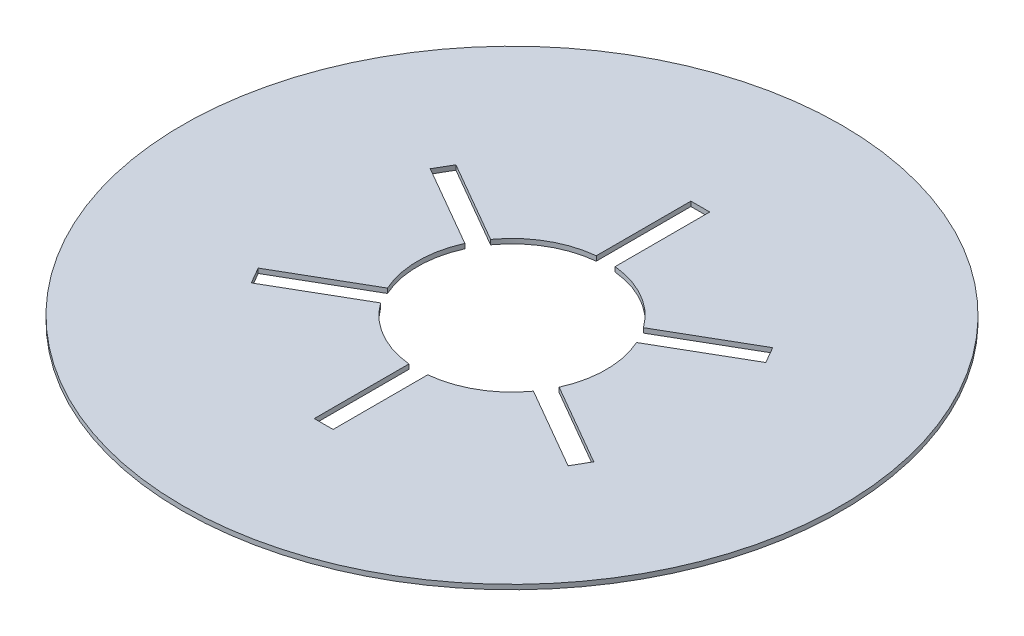
from build123d import *

# Parameters (mm, degrees)
IZIM1_R                     = 350
Y_KSEKLIK_EKSTR_ZYON1_DEPTH = 5


with BuildPart() as part:
    # Çizim1 → Yükseklik-Ekstrüzyon1 (new body)
    # profile 1 of 7: a face of its own
    with BuildSketch(Plane(origin=(0, 0, 0), x_dir=(1, 0, 0), z_dir=(0, 1, 0))):
        with Locations(Location((0, 0, 0), (0, 0, 270))):
            Circle(IZIM1_R)
        with BuildLine():
            ThreePointArc((70.062926922, 71.352549156), (75.892103529, 65.118266423), (81.168439698, 58.409625893))
            Line((81.168439698, 58.409625893), (168.205080757, 108.660254038))
            Line((168.205080757, 108.660254038), (178.205080757, 91.339745962))
            Line((178.205080757, 91.339745962), (91.168439698, 41.089117818))
            ThreePointArc((91.168439698, 41.089117818), (94.340124737, 33.165356392), (96.824583655, 25))
            Line((96.824583655, 25), (150, 55.700840941))
            Line((150, 55.700840941), (150, -55.700840941))
            Line((150, -55.700840941), (96.824583655, -25))
            ThreePointArc((96.824583655, -25), (94.340124737, -33.165356392), (91.168439698, -41.089117817))
            Line((91.168439698, -41.089117817), (178.205080757, -91.339745962))
            Line((178.205080757, -91.339745962), (168.205080757, -108.660254038))
            Line((168.205080757, -108.660254038), (81.168439698, -58.409625893))
            ThreePointArc((81.168439698, -58.409625893), (75.892103529, -65.118266423), (70.062926922, -71.352549156))
            Line((70.062926922, -71.352549156), (123.238343267, -102.053390097))
            Line((123.238343267, -102.053390097), (26.761656733, -157.754231038))
            Line((26.761656733, -157.754231038), (26.761656733, -96.352549156))
            ThreePointArc((26.761656733, -96.352549156), (18.448021208, -98.283622814), (10, -99.498743711))
            Line((10, -99.498743711), (10, -200))
            Line((10, -200), (-10, -200))
            Line((-10, -200), (-10, -99.498743711))
            ThreePointArc((-10, -99.498743711), (-18.448021208, -98.283622814), (-26.761656733, -96.352549156))
            Line((-26.761656733, -96.352549156), (-26.761656733, -157.754231038))
            Line((-26.761656733, -157.754231038), (-123.238343267, -102.053390097))
            Line((-123.238343267, -102.053390097), (-70.062926922, -71.352549156))
            ThreePointArc((-70.062926922, -71.352549156), (-75.892103529, -65.118266423), (-81.168439698, -58.409625893))
            Line((-81.168439698, -58.409625893), (-168.205080757, -108.660254038))
            Line((-168.205080757, -108.660254038), (-178.205080757, -91.339745962))
            Line((-178.205080757, -91.339745962), (-91.168439698, -41.089117817))
            ThreePointArc((-91.168439698, -41.089117817), (-94.340124737, -33.165356392), (-96.824583655, -25))
            Line((-96.824583655, -25), (-150, -55.700840941))
            Line((-150, -55.700840941), (-150, 55.700840941))
            Line((-150, 55.700840941), (-96.824583655, 25))
            ThreePointArc((-96.824583655, 25), (-94.340124737, 33.165356392), (-91.168439698, 41.089117818))
            Line((-91.168439698, 41.089117818), (-178.205080757, 91.339745962))
            Line((-178.205080757, 91.339745962), (-168.205080757, 108.660254038))
            Line((-168.205080757, 108.660254038), (-81.168439698, 58.409625893))
            ThreePointArc((-81.168439698, 58.409625893), (-75.892103529, 65.118266423), (-70.062926922, 71.352549156))
            Line((-70.062926922, 71.352549156), (-123.238343267, 102.053390097))
            Line((-123.238343267, 102.053390097), (-26.761656733, 157.754231038))
            Line((-26.761656733, 157.754231038), (-26.761656733, 96.352549156))
            ThreePointArc((-26.761656733, 96.352549156), (-18.448021208, 98.283622814), (-10, 99.498743711))
            Line((-10, 99.498743711), (-10, 200))
            Line((-10, 200), (10, 200))
            Line((10, 200), (10, 99.498743711))
            ThreePointArc((10, 99.498743711), (18.448021208, 98.283622814), (26.761656733, 96.352549156))
            Line((26.761656733, 96.352549156), (26.761656733, 157.754231038))
            Line((26.761656733, 157.754231038), (123.238343267, 102.053390097))
            Line((123.238343267, 102.053390097), (70.062926922, 71.352549156))
        make_face(mode=Mode.SUBTRACT)
    # profile 2 of 7: a face of its own
    with BuildSketch(Plane(origin=(0, 0, 0), x_dir=(1, 0, 0), z_dir=(0, 1, 0))):
        with BuildLine():
            Line((-26.761656733, -157.754231038), (-26.761656733, -96.352549156))
            ThreePointArc((-26.761656733, -96.352549156), (-50, -86.602540378), (-70.062926922, -71.352549156))
            Line((-70.062926922, -71.352549156), (-123.238343267, -102.053390097))
            Line((-123.238343267, -102.053390097), (-26.761656733, -157.754231038))
        make_face()
    # profile 3 of 7: a face of its own
    with BuildSketch(Plane(origin=(0, 0, 0), x_dir=(1, 0, 0), z_dir=(0, 1, 0))):
        with BuildLine():
            ThreePointArc((-96.824583655, -25), (-100, 0), (-96.824583655, 25))
            Line((-96.824583655, 25), (-150, 55.700840941))
            Line((-150, 55.700840941), (-150, -55.700840941))
            Line((-150, -55.700840941), (-96.824583655, -25))
        make_face()
    # profile 4 of 7: a face of its own
    with BuildSketch(Plane(origin=(0, 0, 0), x_dir=(1, 0, 0), z_dir=(0, 1, 0))):
        with BuildLine():
            ThreePointArc((-70.062926922, 71.352549156), (-50, 86.602540378), (-26.761656733, 96.352549156))
            Line((-26.761656733, 96.352549156), (-26.761656733, 157.754231038))
            Line((-26.761656733, 157.754231038), (-123.238343267, 102.053390097))
            Line((-123.238343267, 102.053390097), (-70.062926922, 71.352549156))
        make_face()
    # profile 5 of 7: a face of its own
    with BuildSketch(Plane(origin=(0, 0, 0), x_dir=(1, 0, 0), z_dir=(0, 1, 0))):
        with BuildLine():
            ThreePointArc((26.761656733, 96.352549156), (50, 86.602540378), (70.062926922, 71.352549156))
            Line((70.062926922, 71.352549156), (123.238343267, 102.053390097))
            Line((123.238343267, 102.053390097), (26.761656733, 157.754231038))
            Line((26.761656733, 157.754231038), (26.761656733, 96.352549156))
        make_face()
    # profile 6 of 7: a face of its own
    with BuildSketch(Plane(origin=(0, 0, 0), x_dir=(1, 0, 0), z_dir=(0, 1, 0))):
        with BuildLine():
            Line((150, 55.700840941), (96.824583655, 25))
            ThreePointArc((96.824583655, 25), (100, 0), (96.824583655, -25))
            Line((96.824583655, -25), (150, -55.700840941))
            Line((150, -55.700840941), (150, 55.700840941))
        make_face()
    # profile 7 of 7: a face of its own
    with BuildSketch(Plane(origin=(0, 0, 0), x_dir=(1, 0, 0), z_dir=(0, 1, 0))):
        with BuildLine():
            Line((123.238343267, -102.053390097), (70.062926922, -71.352549156))
            ThreePointArc((70.062926922, -71.352549156), (50, -86.602540378), (26.761656733, -96.352549156))
            Line((26.761656733, -96.352549156), (26.761656733, -157.754231038))
            Line((26.761656733, -157.754231038), (123.238343267, -102.053390097))
        make_face()
    extrude(amount=Y_KSEKLIK_EKSTR_ZYON1_DEPTH)


solid = part.part
